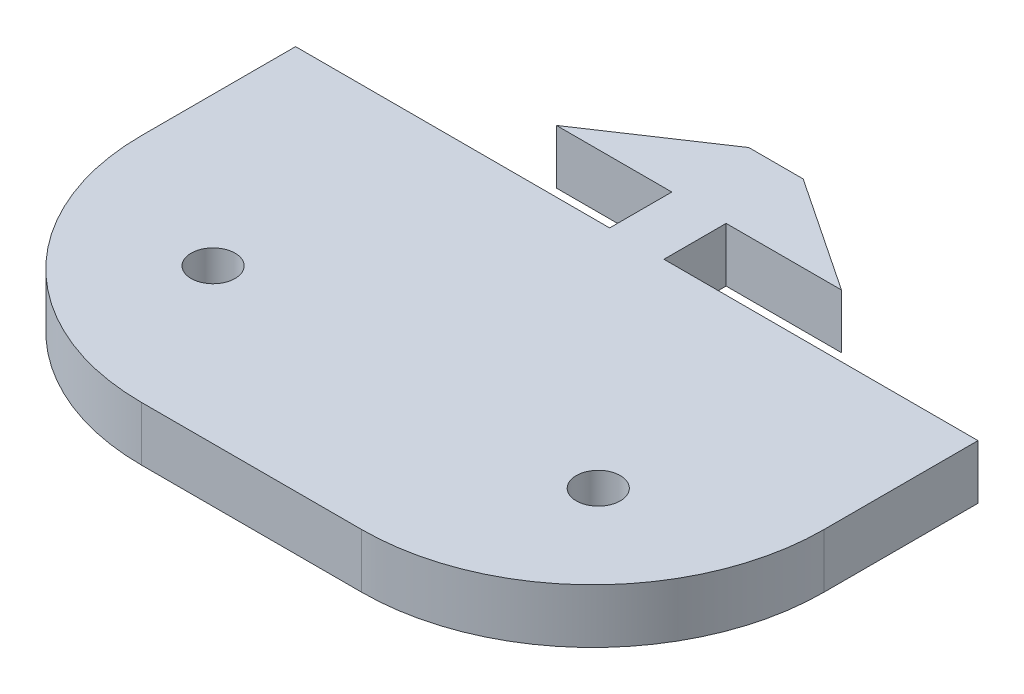
from build123d import *

# Parameters (mm, degrees)
BOSS_EXTRUDE1_DEPTH = 3.5814
SKETCH2_R           = 1.45
CUT_EXTRUDE1_DEPTH  = 36.673224216
FILLET1_R           = 15.24


with BuildPart() as part:
    # Sketch1 → Boss-Extrude1 (new body)
    with BuildSketch(Plane(origin=(0, 0, 0), x_dir=(1, 0, 0), z_dir=(0, 1, 0))):
        Polygon((-22.5, -27.45), (22.5, -27.45), (22.5, -2.05), (1.7907, -2.05), (1.7907, 2.05), (9.398, 2.05), (1.7907, 7.13), (-1.7907, 7.13), (-9.398, 2.05), (-1.7907, 2.05), (-1.7907, -2.05), (-22.5, -2.05), align=None)
    extrude(amount=BOSS_EXTRUDE1_DEPTH)

    # Sketch2 → Cut-Extrude1 (cut, through all)
    with BuildSketch(Plane(origin=(0, 3.5814, 0), x_dir=(1, 0, 0), z_dir=(0, 1, 0))):
        with Locations(Location((-12.7, -17.29, 0), (0, 0, 270))):
            Circle(SKETCH2_R)
        with Locations(Location((12.7, -17.29, 0), (0, 0, 270))):
            Circle(SKETCH2_R)
    extrude(amount=-CUT_EXTRUDE1_DEPTH, mode=Mode.SUBTRACT)

    # Fillet1
    fillet1_edges = [part.edges().sort_by_distance(p)[0] for p in [
        (-22.5, 1.7907, 27.45),
        (22.5, 1.7907, 27.45),
    ]]
    fillet(fillet1_edges, radius=FILLET1_R)


solid = part.part
